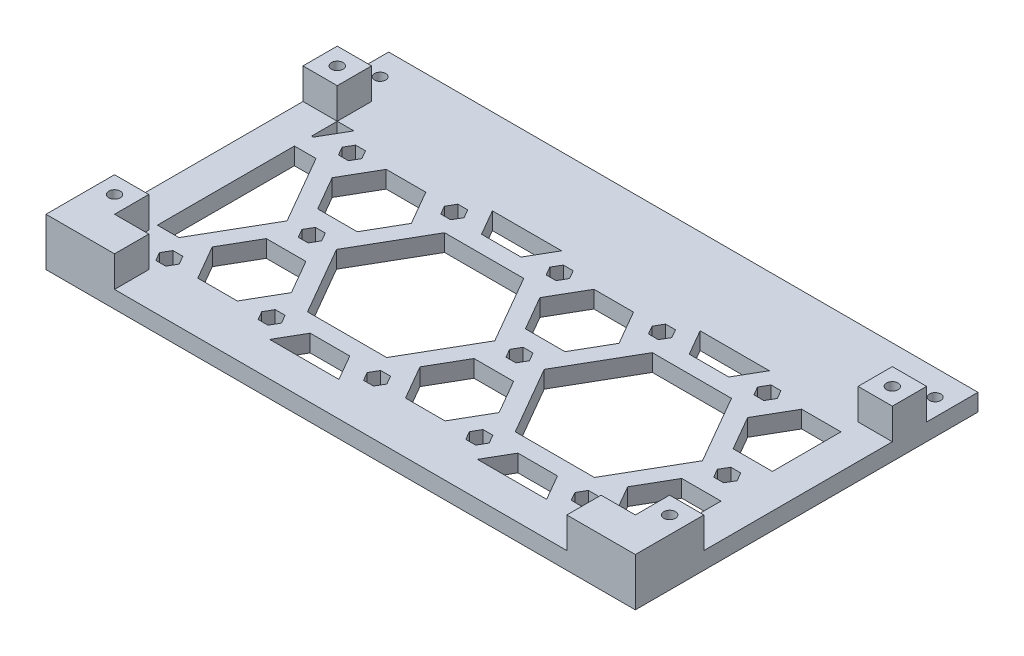
from build123d import *

# Parameters (mm, degrees)
SKETCH1_W           = 172
SKETCH1_H           = 100
SKETCH1_R           = 15
BOSS_EXTRUDE1_DEPTH = 2.5
BOSS_EXTRUDE2_START = 2.5
SKETCH1_3_W         = 172
SKETCH1_3_H         = 100
SKETCH1_3_R         = 1.655795395
SKETCH1_3_R_2       = 15
BOSS_EXTRUDE2_DEPTH = 2.5
SKETCH3_W           = 10
SKETCH3_H           = 10
BOSS_EXTRUDE3_DEPTH = 9
SKETCH4_R           = 1.7
CUT_EXTRUDE1_DEPTH  = 200.449241663
CUT_EXTRUDE2_DEPTH  = 2.5
CUT_EXTRUDE3_DEPTH  = 200.160739103
SKETCH6_3_R         = 15
SKETCH6_3_W         = 5.689110868
SKETCH6_3_H         = 20
CUT_EXTRUDE4_DEPTH  = 10


with BuildPart() as part:
    # Sketch1 → Boss-Extrude1 (new body)
    with BuildSketch(Plane(origin=(0, 0, 0), x_dir=(1, 0, 0), z_dir=(0, 1, 0))):
        with Locations((86, 50)):
            Rectangle(SKETCH1_W, SKETCH1_H)
        with Locations(Location((126, 42.5, 0), (0, 0, 270))):
            Circle(SKETCH1_R, mode=Mode.SUBTRACT)
    extrude(amount=-BOSS_EXTRUDE1_DEPTH)

    # Sketch1<3> → Boss-Extrude2 (add)
    with BuildSketch(Plane(origin=(0, 0, 0), x_dir=(1, 0, 0), z_dir=(0, 1, 0)).offset(BOSS_EXTRUDE2_START)):
        with Locations((86, 50)):
            Rectangle(SKETCH1_3_W, SKETCH1_3_H)
        with Locations(Location((167, 92.5, 0), (0, 0, 270))):
            Circle(SKETCH1_3_R, mode=Mode.SUBTRACT)
        with Locations(Location((5, 92.5, 0), (0, 0, 270))):
            Circle(SKETCH1_3_R, mode=Mode.SUBTRACT)
        with Locations(Location((126, 42.5, 0), (0, 0, 270))):
            Circle(SKETCH1_3_R_2, mode=Mode.SUBTRACT)
    extrude(amount=-BOSS_EXTRUDE2_DEPTH)

    # Sketch3 → Boss-Extrude3 (add)
    with BuildSketch(Plane(origin=(0, 2.5, 0), x_dir=(1, 0, 0), z_dir=(0, 1, 0))):
        with Locations((5, 80)):
            Rectangle(SKETCH3_W, SKETCH3_H)
        Polygon((10, 20), (0, 20), (0, 0), (20, 0), (20, 10), (10, 10), align=None)
        Polygon((172, 0), (172, 20), (162, 20), (162, 10), (152, 10), (152, 0), align=None)
        with Locations((167, 80)):
            Rectangle(SKETCH3_W, SKETCH3_H)
    extrude(amount=BOSS_EXTRUDE3_DEPTH)

    # Sketch4 → Cut-Extrude1 (cut, through all)
    with BuildSketch(Plane(origin=(0, 11.5, 0), x_dir=(1, 0, 0), z_dir=(0, 1, 0))):
        with Locations(Location((5, 80, 0), (0, 0, 270))):
            Circle(SKETCH4_R)
        with Locations(Location((5, 15, 0), (0, 0, 270))):
            Circle(SKETCH4_R)
        with Locations(Location((167, 15, 0), (0, 0, 270))):
            Circle(SKETCH4_R)
        with Locations(Location((167, 80, 0), (0, 0, 270))):
            Circle(SKETCH4_R)
    extrude(amount=-CUT_EXTRUDE1_DEPTH, mode=Mode.SUBTRACT)

    # Sketch5 → Cut-Extrude2 (cut)
    with BuildSketch(Plane(origin=(0, -2.5, 0), x_dir=(-1, 0, 0), z_dir=(0, -1, 0))):
        Polygon((-163.766838493, 80), (-165.383419246, 82.8), (-168.616580754, 82.8), (-170.233161507, 80), (-168.616580754, 77.2), (-165.383419246, 77.2), align=None)
        Polygon((-163.766838493, 15), (-165.383419246, 17.8), (-168.616580754, 17.8), (-170.233161507, 15), (-168.616580754, 12.2), (-165.383419246, 12.2), align=None)
        Polygon((-1.766838493, 15), (-3.383419246, 17.8), (-6.616580754, 17.8), (-8.233161507, 15), (-6.616580754, 12.2), (-3.383419246, 12.2), align=None)
        Polygon((-1.766838493, 80), (-3.383419246, 82.8), (-6.616580754, 82.8), (-8.233161507, 80), (-6.616580754, 77.2), (-3.383419246, 77.2), align=None)
    extrude(amount=-CUT_EXTRUDE2_DEPTH, mode=Mode.SUBTRACT)

    # Sketch6 → Cut-Extrude3 (cut, through all)
    with BuildSketch(Plane(origin=(0, 2.5, 0), x_dir=(1, 0, 0), z_dir=(0, 1, 0))):
        Polygon((14.860073181, 75), (10, 75), (10, 67.5), (10.529946162, 67.5), align=None)
        Polygon((55.274592024, 75), (59.604719043, 67.5), (71.151724427, 67.5), (75.481851446, 75), align=None)
        Polygon((16.303448854, 62.5), (10, 62.5), (10, 22.5), (16.303448854, 22.5), (27.850454238, 42.5), align=None)
        Polygon((10.529946162, 17.5), (10, 17.5), (10, 10), (14.860073181, 10), align=None)
        Polygon((59.604719043, 17.5), (55.274592024, 10), (75.481851446, 10), (71.151724427, 17.5), align=None)
        Polygon((107.236116251, 25), (101.462613559, 35), (89.915608176, 35), (84.142105484, 25), (89.915608176, 15), (101.462613559, 15), align=None)
        Polygon((101.462613559, 50), (107.236116251, 60), (101.462613559, 70), (89.915608176, 70), (84.142105484, 60), (89.915608176, 50), align=None)
        Polygon((77.878641442, 69.151362049), (79.322017115, 66.651362049), (82.208768461, 66.651362049), (83.652144134, 69.151362049), (82.208768461, 71.651362049), (79.322017115, 71.651362049), align=None)
        Polygon((82.208768461, 18.348637951), (79.322017115, 18.348637951), (77.878641442, 15.848637951), (79.322017115, 13.348637951), (82.208768461, 13.348637951), (83.652144134, 15.848637951), align=None)
        Polygon((46.614337986, 25), (40.840835295, 35), (29.293829911, 35), (23.520327219, 25), (29.293829911, 15), (40.840835295, 15), align=None)
        Polygon((53.831216351, 62.5), (42.284210967, 42.5), (53.831216351, 22.5), (76.925227119, 22.5), (88.472232503, 42.5), (76.925227119, 62.5), align=None)
        Polygon((40.840835295, 50), (46.614337986, 60), (40.840835295, 70), (29.293829911, 70), (23.520327219, 60), (29.293829911, 50), align=None)
        Polygon((97.132486541, 40), (98.575862214, 42.5), (97.132486541, 45), (94.245735195, 45), (92.802359522, 42.5), (94.245735195, 40), align=None)
        Polygon((36.510708276, 40), (37.954083949, 42.5), (36.510708276, 45), (33.62395693, 45), (32.180581257, 42.5), (33.62395693, 40), align=None)
        Polygon((48.547675009, 71.651362049), (47.104299336, 69.151362049), (48.547675009, 66.651362049), (51.434426355, 66.651362049), (52.877802028, 69.151362049), (51.434426355, 71.651362049), align=None)
        Polygon((23.030365869, 69.151362049), (21.586990196, 71.651362049), (18.70023885, 71.651362049), (17.256863177, 69.151362049), (18.70023885, 66.651362049), (21.586990196, 66.651362049), align=None)
        Polygon((21.586990196, 13.348637951), (23.030365869, 15.848637951), (21.586990196, 18.348637951), (18.70023885, 18.348637951), (17.256863177, 15.848637951), (18.70023885, 13.348637951), align=None)
        Polygon((47.104299336, 15.848637951), (48.547675009, 13.348637951), (51.434426355, 13.348637951), (52.877802028, 15.848637951), (51.434426355, 18.348637951), (48.547675009, 18.348637951), align=None)
    extrude(amount=-CUT_EXTRUDE3_DEPTH, mode=Mode.SUBTRACT)

    # Sketch6<3> → Cut-Extrude4 (cut)
    # profile 1 of 14: a face of its own
    with BuildSketch(Plane(origin=(0, 2.5, 0), x_dir=(1, 0, 0), z_dir=(0, 1, 0))):
        Polygon((136.103629711, 75), (126, 75), (126, 67.5), (131.773502692, 67.5), align=None)
    # profile 2 of 14: a face of its own
    with BuildSketch(Plane(origin=(0, 2.5, 0), x_dir=(1, 0, 0), z_dir=(0, 1, 0))):
        Polygon((126, 75), (115.896370289, 75), (120.226497308, 67.5), (126, 67.5), align=None)
    # profile 3 of 14: a face of its own
    with BuildSketch(Plane(origin=(0, 2.5, 0), x_dir=(1, 0, 0), z_dir=(0, 1, 0))):
        Polygon((109.169453274, 66.651362049), (107.726077601, 69.151362049), (109.169453274, 71.651362049), (112.05620462, 71.651362049), (113.499580293, 69.151362049), (112.05620462, 66.651362049), align=None)
    # profile 4 of 14: a face of its own
    with BuildSketch(Plane(origin=(0, 2.5, 0), x_dir=(1, 0, 0), z_dir=(0, 1, 0))):
        Polygon((114.452994616, 22.5), (137.547005384, 22.5), (149.094010768, 42.5), (137.547005384, 62.5), (114.452994616, 62.5), (102.905989232, 42.5), align=None)
        with Locations((126, 42.5)):
            Circle(SKETCH6_3_R, mode=Mode.SUBTRACT)
    # profile 5 of 14: a face of its own
    with BuildSketch(Plane(origin=(0, 2.5, 0), x_dir=(1, 0, 0), z_dir=(0, 1, 0))):
        Polygon((138.500419707, 69.151362049), (139.94379538, 66.651362049), (142.830546726, 66.651362049), (144.273922399, 69.151362049), (142.830546726, 71.651362049), (139.94379538, 71.651362049), align=None)
    # profile 6 of 14: a face of its own
    with BuildSketch(Plane(origin=(0, 2.5, 0), x_dir=(1, 0, 0), z_dir=(0, 1, 0))):
        Polygon((156.310889132, 50), (156.310889132, 70), (150.537386441, 70), (144.763883749, 60), (150.537386441, 50), align=None)
    # profile 7 of 14: a face of its own
    with BuildSketch(Plane(origin=(0, 2.5, 0), x_dir=(1, 0, 0), z_dir=(0, 1, 0))):
        with Locations((159.155444566, 60)):
            Rectangle(SKETCH6_3_W, SKETCH6_3_H)
    # profile 8 of 14: a face of its own
    with BuildSketch(Plane(origin=(0, 2.5, 0), x_dir=(1, 0, 0), z_dir=(0, 1, 0))):
        with Locations((159.155444566, 25)):
            Rectangle(SKETCH6_3_W, SKETCH6_3_H)
    # profile 9 of 14: a face of its own
    with BuildSketch(Plane(origin=(0, 2.5, 0), x_dir=(1, 0, 0), z_dir=(0, 1, 0))):
        Polygon((156.310889132, 15), (156.310889132, 35), (150.537386441, 35), (144.763883749, 25), (150.537386441, 15), align=None)
    # profile 10 of 14: a face of its own
    with BuildSketch(Plane(origin=(0, 2.5, 0), x_dir=(1, 0, 0), z_dir=(0, 1, 0))):
        Polygon((138.500419707, 15.848637951), (139.94379538, 18.348637951), (142.830546726, 18.348637951), (144.273922399, 15.848637951), (142.830546726, 13.348637951), (139.94379538, 13.348637951), align=None)
    # profile 11 of 14: a face of its own
    with BuildSketch(Plane(origin=(0, 2.5, 0), x_dir=(1, 0, 0), z_dir=(0, 1, 0))):
        Polygon((126, 17.5), (126, 10), (136.103629711, 10), (131.773502692, 17.5), align=None)
    # profile 12 of 14: a face of its own
    with BuildSketch(Plane(origin=(0, 2.5, 0), x_dir=(1, 0, 0), z_dir=(0, 1, 0))):
        Polygon((120.226497308, 17.5), (115.896370289, 10), (126, 10), (126, 17.5), align=None)
    # profile 13 of 14: a face of its own
    with BuildSketch(Plane(origin=(0, 2.5, 0), x_dir=(1, 0, 0), z_dir=(0, 1, 0))):
        Polygon((113.499580293, 15.848637951), (112.05620462, 18.348637951), (109.169453274, 18.348637951), (107.726077601, 15.848637951), (109.169453274, 13.348637951), (112.05620462, 13.348637951), align=None)
    # profile 14 of 14: a face of its own
    with BuildSketch(Plane(origin=(0, 2.5, 0), x_dir=(1, 0, 0), z_dir=(0, 1, 0))):
        Polygon((153.424137786, 42.5), (154.867513459, 45), (157.754264805, 45), (159.197640478, 42.5), (157.754264805, 40), (154.867513459, 40), align=None)
    extrude(amount=-CUT_EXTRUDE4_DEPTH, mode=Mode.SUBTRACT)


solid = part.part
